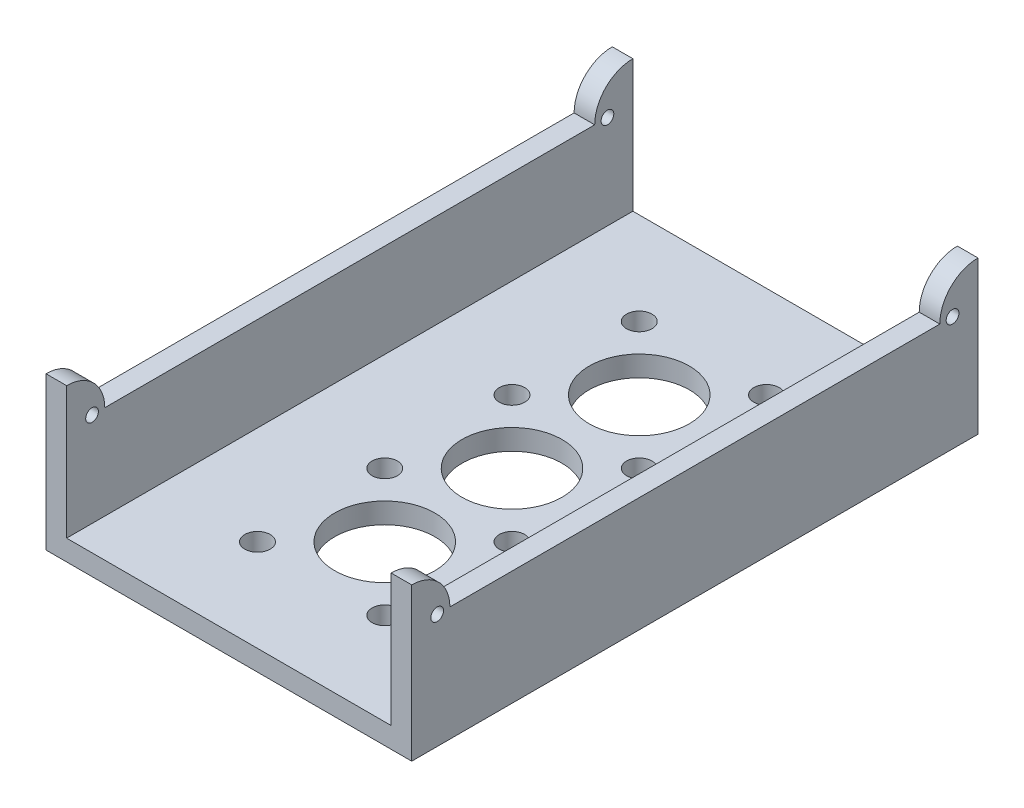
from build123d import *

# Parameters (mm, degrees)
BOSS_EXTRUDE1_DEPTH = 44.5
SKETCH2_R           = 0.5
CUT_EXTRUDE1_DEPTH  = 44.5
SKETCH3_R           = 3.935
SKETCH3_R_2         = 1
CUT_EXTRUDE2_DEPTH  = 20.5


with BuildPart() as part:
    # Sketch1 → Boss-Extrude1 (new body)
    with BuildSketch(Plane.XY):
        Polygon((0, 0), (-14.37, 0), (-14.37, 12), (-12.75, 12), (-12.75, 1.62), (0, 1.62), align=None)
    boss_extrude1 = extrude(amount=BOSS_EXTRUDE1_DEPTH)

    # Sketch2 → Cut-Extrude1 (cut)
    with BuildSketch(Plane.ZY.offset(14.37)):
        with Locations((2, 9)):
            Circle(SKETCH2_R)
        with Locations((42.5, 9)):
            Circle(SKETCH2_R)
        with BuildLine():
            Line((3, 9), (41.5, 9))
            ThreePointArc((41.5, 9), (42.378679656, 11.121320344), (44.5, 12))
            Line((44.5, 12), (44.5, 14.744822673))
            Line((44.5, 14.744822673), (0, 14.744822673))
            Line((0, 14.744822673), (0, 12))
            ThreePointArc((0, 12), (2.121320344, 11.121320344), (3, 9))
        make_face()
    cut_extrude1 = extrude(amount=-CUT_EXTRUDE1_DEPTH, mode=Mode.SUBTRACT)

    # Mirror1: Boss-Extrude1, Cut-Extrude1 across plane
    add(boss_extrude1.mirror(Plane(origin=(0, 1.62, 44.5), x_dir=(0, 0, 1), z_dir=(-1, 0, 0))))
    add(cut_extrude1.mirror(Plane(origin=(0, 1.62, 44.5), x_dir=(0, 0, 1), z_dir=(-1, 0, 0))), mode=Mode.SUBTRACT)

    # Sketch3 → Cut-Extrude2 (cut)
    with BuildSketch(Plane(origin=(0, 0, 0), x_dir=(1, 0, 0), z_dir=(0, 1, 0))):
        with Locations((0, -12.25)):
            Circle(SKETCH3_R)
        with Locations((-5, -7.25)):
            Circle(SKETCH3_R_2)
        with Locations((5, -7.25)):
            Circle(SKETCH3_R_2)
        with Locations((5, -17.25)):
            Circle(SKETCH3_R_2)
        with Locations((-5, -17.25)):
            Circle(SKETCH3_R_2)
        with Locations((0, -22.25)):
            Circle(SKETCH3_R)
        with Locations((-5, -27.25)):
            Circle(SKETCH3_R_2)
        with Locations((5, -27.25)):
            Circle(SKETCH3_R_2)
        with Locations((0, -32.25)):
            Circle(SKETCH3_R)
        with Locations((-5, -37.25)):
            Circle(SKETCH3_R_2)
        with Locations((5, -37.25)):
            Circle(SKETCH3_R_2)
    extrude(amount=CUT_EXTRUDE2_DEPTH, mode=Mode.SUBTRACT)


solid = part.part
